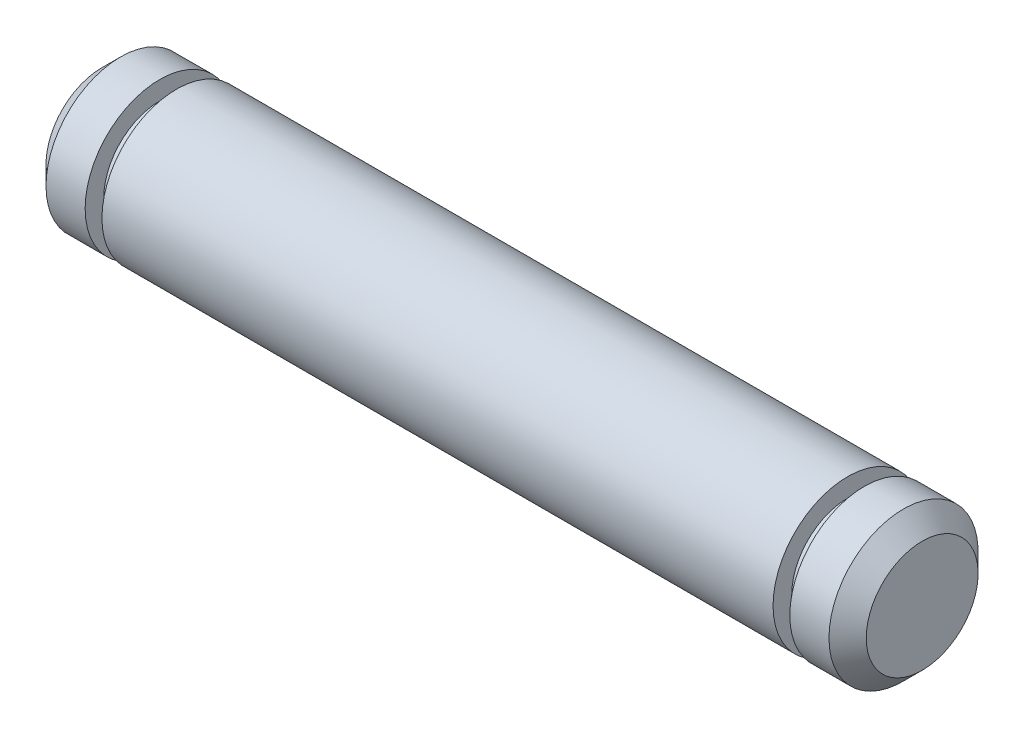
from build123d import *

# Parameters (mm, degrees)
CHAMFER1_SIZE = 1


with BuildPart() as part:
    # Sketch1 → Revolve1 (revolve)
    with BuildSketch(Plane.XY, mode=Mode.PRIVATE) as revolve1_sk:
        Polygon((0, 0), (0, 4), (3.1, 4), (3.1, 3), (4, 3), (4, 4), (40, 4), (40, 3), (40.9, 3), (40.9, 4), (44, 4), (44, 0), align=None)
    revolve(revolve1_sk.sketch.rotate(Axis((0, 0, 0), (1, 0, 0)), 90), axis=Axis((0, 0, 0), (1, 0, 0)))

    # Chamfer1
    chamfer1_edges = [part.edges().sort_by_distance(p)[0] for p in [
        (0, 0, -4),
        (44, 0, -4),
    ]]
    chamfer(chamfer1_edges, length=CHAMFER1_SIZE)


solid = part.part
